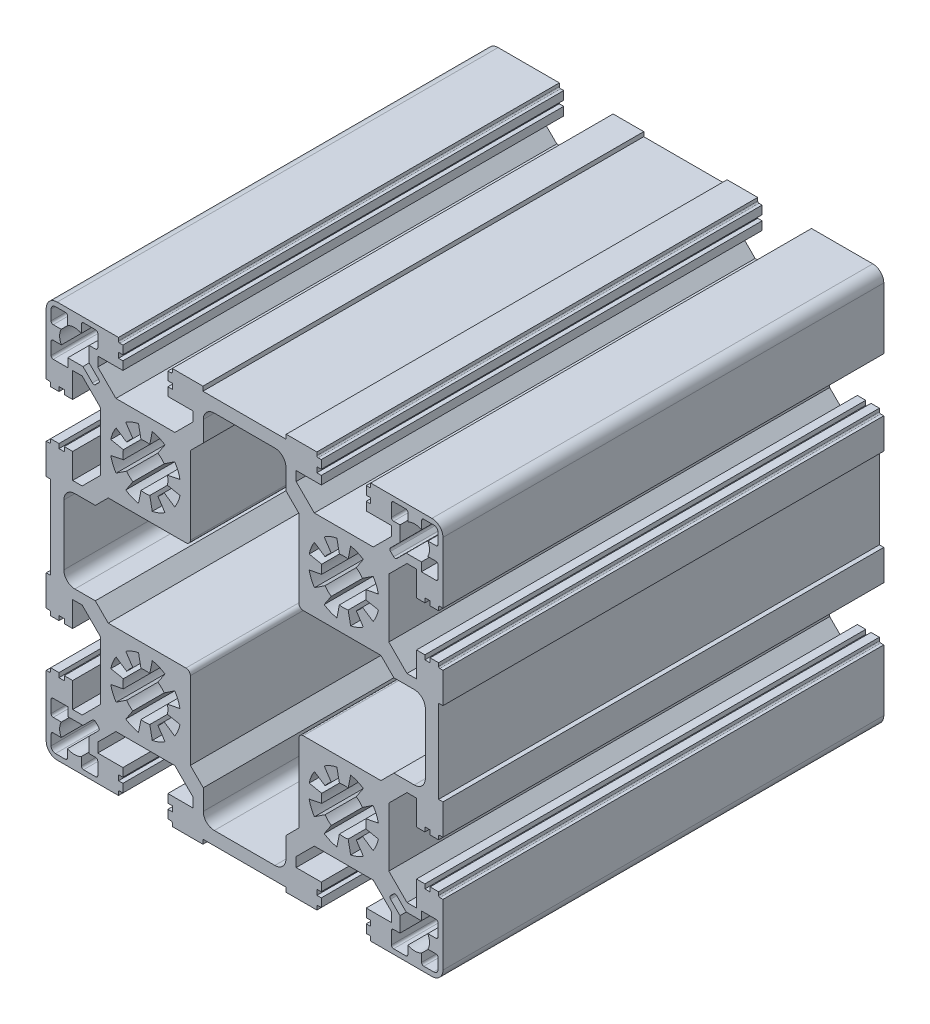
from build123d import *

# Parameters (mm, degrees)
EXTRUDE_1_DEPTH = 100


with BuildPart() as part:
    # 草图1 → 凸台-拉伸1 (new body)
    with BuildSketch(Plane.XY):
        with BuildLine():
            Line((-27.568782805, 44.545792426), (-41.468782805, 44.545792426))
            ThreePointArc((-41.468782805, 44.545792426), (-43.236549758, 43.813559379), (-43.968782805, 42.045792426))
            Line((-43.968782805, 42.045792426), (-43.968782805, 28.145792426))
            Line((-43.968782805, 28.145792426), (-43.268782805, 28.145792426))
            ThreePointArc((-43.268782805, 28.145792426), (-43.056650771, 28.057924461), (-42.968782805, 27.845792426))
            Line((-42.968782805, 27.845792426), (-42.968782805, 27.145792426))
            Line((-42.968782805, 27.145792426), (-41.068782805, 27.145792426))
            Line((-41.068782805, 27.145792426), (-41.068782805, 28.145792426))
            Line((-41.068782805, 28.145792426), (-39.868782805, 28.145792426))
            Line((-39.868782805, 28.145792426), (-39.868782805, 27.145792426))
            Line((-39.868782805, 27.145792426), (-37.968782805, 27.145792426))
            Line((-37.968782805, 27.145792426), (-37.968782805, 32.845792426))
            Line((-37.968782805, 32.845792426), (-35.804316711, 32.845792426))
            Line((-35.804316711, 32.845792426), (-31.688782805, 28.73025852))
            Line((-31.688782805, 28.73025852), (-31.688782805, 15.361326332))
            Line((-31.688782805, 15.361326332), (-35.804316711, 11.245792426))
            Line((-35.804316711, 11.245792426), (-37.968782805, 11.245792426))
            Line((-37.968782805, 11.245792426), (-37.968782805, 16.945792426))
            Line((-37.968782805, 16.945792426), (-39.868782805, 16.945792426))
            Line((-39.868782805, 16.945792426), (-39.868782805, 15.945792426))
            Line((-39.868782805, 15.945792426), (-41.068782805, 15.945792426))
            Line((-41.068782805, 15.945792426), (-41.068782805, 16.945792426))
            Line((-41.068782805, 16.945792426), (-42.968782805, 16.945792426))
            Line((-42.968782805, 16.945792426), (-42.968782805, 16.245792426))
            ThreePointArc((-42.968782805, 16.245792426), (-43.056650771, 16.033660392), (-43.268782805, 15.945792426))
            Line((-43.268782805, 15.945792426), (-43.968782805, 15.945792426))
            Line((-43.968782805, 15.945792426), (-43.968782805, 8.995792433))
            Line((-43.968782805, 8.995792433), (-42.968782805, 8.995792433))
            Line((-42.968782805, 8.995792433), (-42.968782805, -9.904207567))
            Line((-42.968782805, -9.904207567), (-43.968782805, -9.904207567))
            Line((-43.968782805, -9.904207567), (-43.968782805, -16.854207574))
            Line((-43.968782805, -16.854207574), (-43.268782805, -16.854207574))
            ThreePointArc((-43.268782805, -16.854207574), (-43.056650771, -16.942075539), (-42.968782805, -17.154207574))
            Line((-42.968782805, -17.154207574), (-42.968782805, -17.854207574))
            Line((-42.968782805, -17.854207574), (-41.068782805, -17.854207574))
            Line((-41.068782805, -17.854207574), (-41.068782805, -16.854207574))
            Line((-41.068782805, -16.854207574), (-39.868782805, -16.854207574))
            Line((-39.868782805, -16.854207574), (-39.868782805, -17.854207574))
            Line((-39.868782805, -17.854207574), (-37.968782805, -17.854207574))
            Line((-37.968782805, -17.854207574), (-37.968782805, -12.154207574))
            Line((-37.968782805, -12.154207574), (-35.804316711, -12.154207574))
            Line((-35.804316711, -12.154207574), (-31.688782805, -16.26974148))
            Line((-31.688782805, -16.26974148), (-31.688782805, -29.638673668))
            Line((-31.688782805, -29.638673668), (-35.804316711, -33.754207574))
            Line((-35.804316711, -33.754207574), (-37.968782805, -33.754207574))
            Line((-37.968782805, -33.754207574), (-37.968782805, -28.054207574))
            Line((-37.968782805, -28.054207574), (-39.868782805, -28.054207574))
            Line((-39.868782805, -28.054207574), (-39.868782805, -29.054207574))
            Line((-39.868782805, -29.054207574), (-41.068782805, -29.054207574))
            Line((-41.068782805, -29.054207574), (-41.068782805, -28.054207574))
            Line((-41.068782805, -28.054207574), (-42.968782805, -28.054207574))
            Line((-42.968782805, -28.054207574), (-42.968782805, -28.754207574))
            ThreePointArc((-42.968782805, -28.754207574), (-43.056650771, -28.966339608), (-43.268782805, -29.054207574))
            Line((-43.268782805, -29.054207574), (-43.968782805, -29.054207574))
            Line((-43.968782805, -29.054207574), (-43.968782805, -42.954207574))
            ThreePointArc((-43.968782805, -42.954207574), (-43.236549758, -44.721974527), (-41.468782805, -45.454207574))
            Line((-41.468782805, -45.454207574), (-27.568782805, -45.454207574))
            Line((-27.568782805, -45.454207574), (-27.568782805, -44.754207574))
            ThreePointArc((-27.568782805, -44.754207574), (-27.480914839, -44.542075539), (-27.268782805, -44.454207574))
            Line((-27.268782805, -44.454207574), (-26.568782805, -44.454207574))
            Line((-26.568782805, -44.454207574), (-26.568782805, -42.554207574))
            Line((-26.568782805, -42.554207574), (-27.568782805, -42.554207574))
            Line((-27.568782805, -42.554207574), (-27.568782805, -41.354207574))
            Line((-27.568782805, -41.354207574), (-26.568782805, -41.354207574))
            Line((-26.568782805, -41.354207574), (-26.568782805, -39.454207574))
            Line((-26.568782805, -39.454207574), (-32.268782805, -39.454207574))
            Line((-32.268782805, -39.454207574), (-32.268782805, -37.28974148))
            Line((-32.268782805, -37.28974148), (-28.153248899, -33.174207574))
            Line((-28.153248899, -33.174207574), (-14.784316711, -33.174207574))
            Line((-14.784316711, -33.174207574), (-10.668782805, -37.28974148))
            Line((-10.668782805, -37.28974148), (-10.668782805, -39.454207574))
            Line((-10.668782805, -39.454207574), (-16.368782805, -39.454207574))
            Line((-16.368782805, -39.454207574), (-16.368782805, -41.354207574))
            Line((-16.368782805, -41.354207574), (-15.368782805, -41.354207574))
            Line((-15.368782805, -41.354207574), (-15.368782805, -42.554207574))
            Line((-15.368782805, -42.554207574), (-16.368782805, -42.554207574))
            Line((-16.368782805, -42.554207574), (-16.368782805, -44.454207574))
            Line((-16.368782805, -44.454207574), (-15.668782805, -44.454207574))
            ThreePointArc((-15.668782805, -44.454207574), (-15.456650771, -44.542075539), (-15.368782805, -44.754207574))
            Line((-15.368782805, -44.754207574), (-15.368782805, -45.454207574))
            Line((-15.368782805, -45.454207574), (-8.418782805, -45.454207574))
            Line((-8.418782805, -45.454207574), (-8.418782805, -44.454207574))
            Line((-8.418782805, -44.454207574), (10.481217195, -44.454207574))
            Line((10.481217195, -44.454207574), (10.481217195, -45.454207574))
            Line((10.481217195, -45.454207574), (17.431217195, -45.454207574))
            Line((17.431217195, -45.454207574), (17.431217195, -44.754207574))
            ThreePointArc((17.431217195, -44.754207574), (17.519085161, -44.542075539), (17.731217195, -44.454207574))
            Line((17.731217195, -44.454207574), (18.431217195, -44.454207574))
            Line((18.431217195, -44.454207574), (18.431217195, -42.554207574))
            Line((18.431217195, -42.554207574), (17.431217195, -42.554207574))
            Line((17.431217195, -42.554207574), (17.431217195, -41.354207574))
            Line((17.431217195, -41.354207574), (18.431217195, -41.354207574))
            Line((18.431217195, -41.354207574), (18.431217195, -39.454207574))
            Line((18.431217195, -39.454207574), (12.731217195, -39.454207574))
            Line((12.731217195, -39.454207574), (12.731217195, -37.28974148))
            Line((12.731217195, -37.28974148), (16.846751101, -33.174207574))
            Line((16.846751101, -33.174207574), (30.215683289, -33.174207574))
            Line((30.215683289, -33.174207574), (34.331217195, -37.28974148))
            Line((34.331217195, -37.28974148), (34.331217195, -39.454207574))
            Line((34.331217195, -39.454207574), (28.631217195, -39.454207574))
            Line((28.631217195, -39.454207574), (28.631217195, -41.354207574))
            Line((28.631217195, -41.354207574), (29.631217195, -41.354207574))
            Line((29.631217195, -41.354207574), (29.631217195, -42.554207574))
            Line((29.631217195, -42.554207574), (28.631217195, -42.554207574))
            Line((28.631217195, -42.554207574), (28.631217195, -44.454207574))
            Line((28.631217195, -44.454207574), (29.331217195, -44.454207574))
            ThreePointArc((29.331217195, -44.454207574), (29.543349229, -44.542075539), (29.631217195, -44.754207574))
            Line((29.631217195, -44.754207574), (29.631217195, -45.454207574))
            Line((29.631217195, -45.454207574), (43.531217195, -45.454207574))
            ThreePointArc((43.531217195, -45.454207574), (45.298984148, -44.721974527), (46.031217195, -42.954207574))
            Line((46.031217195, -42.954207574), (46.031217195, -29.054207574))
            Line((46.031217195, -29.054207574), (45.331217195, -29.054207574))
            ThreePointArc((45.331217195, -29.054207574), (45.119085161, -28.966339608), (45.031217195, -28.754207574))
            Line((45.031217195, -28.754207574), (45.031217195, -28.054207574))
            Line((45.031217195, -28.054207574), (43.131217195, -28.054207574))
            Line((43.131217195, -28.054207574), (43.131217195, -29.054207574))
            Line((43.131217195, -29.054207574), (41.931217195, -29.054207574))
            Line((41.931217195, -29.054207574), (41.931217195, -28.054207574))
            Line((41.931217195, -28.054207574), (40.031217195, -28.054207574))
            Line((40.031217195, -28.054207574), (40.031217195, -33.754207574))
            Line((40.031217195, -33.754207574), (37.866751101, -33.754207574))
            Line((37.866751101, -33.754207574), (33.751217195, -29.638673668))
            Line((33.751217195, -29.638673668), (33.751217195, -16.26974148))
            Line((33.751217195, -16.26974148), (37.866751101, -12.154207574))
            Line((37.866751101, -12.154207574), (40.031217195, -12.154207574))
            Line((40.031217195, -12.154207574), (40.031217195, -17.854207574))
            Line((40.031217195, -17.854207574), (41.931217195, -17.854207574))
            Line((41.931217195, -17.854207574), (41.931217195, -16.854207574))
            Line((41.931217195, -16.854207574), (43.131217195, -16.854207574))
            Line((43.131217195, -16.854207574), (43.131217195, -17.854207574))
            Line((43.131217195, -17.854207574), (45.031217195, -17.854207574))
            Line((45.031217195, -17.854207574), (45.031217195, -17.154207574))
            ThreePointArc((45.031217195, -17.154207574), (45.119085161, -16.942075539), (45.331217195, -16.854207574))
            Line((45.331217195, -16.854207574), (46.031217195, -16.854207574))
            Line((46.031217195, -16.854207574), (46.031217195, -9.904207567))
            Line((46.031217195, -9.904207567), (45.031217195, -9.904207567))
            Line((45.031217195, -9.904207567), (45.031217195, 8.995792433))
            Line((45.031217195, 8.995792433), (46.031217195, 8.995792433))
            Line((46.031217195, 8.995792433), (46.031217195, 15.945792426))
            Line((46.031217195, 15.945792426), (45.331217195, 15.945792426))
            ThreePointArc((45.331217195, 15.945792426), (45.119085161, 16.033660392), (45.031217195, 16.245792426))
            Line((45.031217195, 16.245792426), (45.031217195, 16.945792426))
            Line((45.031217195, 16.945792426), (43.131217195, 16.945792426))
            Line((43.131217195, 16.945792426), (43.131217195, 15.945792426))
            Line((43.131217195, 15.945792426), (41.931217195, 15.945792426))
            Line((41.931217195, 15.945792426), (41.931217195, 16.945792426))
            Line((41.931217195, 16.945792426), (40.031217195, 16.945792426))
            Line((40.031217195, 16.945792426), (40.031217195, 11.245792426))
            Line((40.031217195, 11.245792426), (37.866751101, 11.245792426))
            Line((37.866751101, 11.245792426), (33.751217195, 15.361326332))
            Line((33.751217195, 15.361326332), (33.751217195, 28.73025852))
            Line((33.751217195, 28.73025852), (37.866751101, 32.845792426))
            Line((37.866751101, 32.845792426), (40.031217195, 32.845792426))
            Line((40.031217195, 32.845792426), (40.031217195, 27.145792426))
            Line((40.031217195, 27.145792426), (41.931217195, 27.145792426))
            Line((41.931217195, 27.145792426), (41.931217195, 28.145792426))
            Line((41.931217195, 28.145792426), (43.131217195, 28.145792426))
            Line((43.131217195, 28.145792426), (43.131217195, 27.145792426))
            Line((43.131217195, 27.145792426), (45.031217195, 27.145792426))
            Line((45.031217195, 27.145792426), (45.031217195, 27.845792426))
            ThreePointArc((45.031217195, 27.845792426), (45.119085161, 28.057924461), (45.331217195, 28.145792426))
            Line((45.331217195, 28.145792426), (46.031217195, 28.145792426))
            Line((46.031217195, 28.145792426), (46.031217195, 42.045792426))
            ThreePointArc((46.031217195, 42.045792426), (45.298984148, 43.813559379), (43.531217195, 44.545792426))
            Line((43.531217195, 44.545792426), (29.631217195, 44.545792426))
            Line((29.631217195, 44.545792426), (29.631217195, 43.845792426))
            ThreePointArc((29.631217195, 43.845792426), (29.543349229, 43.633660392), (29.331217195, 43.545792426))
            Line((29.331217195, 43.545792426), (28.631217195, 43.545792426))
            Line((28.631217195, 43.545792426), (28.631217195, 41.645792426))
            Line((28.631217195, 41.645792426), (29.631217195, 41.645792426))
            Line((29.631217195, 41.645792426), (29.631217195, 40.445792426))
            Line((29.631217195, 40.445792426), (28.631217195, 40.445792426))
            Line((28.631217195, 40.445792426), (28.631217195, 38.545792426))
            Line((28.631217195, 38.545792426), (34.331217195, 38.545792426))
            Line((34.331217195, 38.545792426), (34.331217195, 36.381326332))
            Line((34.331217195, 36.381326332), (30.215683289, 32.265792426))
            Line((30.215683289, 32.265792426), (16.846751101, 32.265792426))
            Line((16.846751101, 32.265792426), (12.731217195, 36.381326332))
            Line((12.731217195, 36.381326332), (12.731217195, 38.545792426))
            Line((12.731217195, 38.545792426), (18.431217195, 38.545792426))
            Line((18.431217195, 38.545792426), (18.431217195, 40.445792426))
            Line((18.431217195, 40.445792426), (17.431217195, 40.445792426))
            Line((17.431217195, 40.445792426), (17.431217195, 41.645792426))
            Line((17.431217195, 41.645792426), (18.431217195, 41.645792426))
            Line((18.431217195, 41.645792426), (18.431217195, 43.545792426))
            Line((18.431217195, 43.545792426), (17.731217195, 43.545792426))
            ThreePointArc((17.731217195, 43.545792426), (17.519085161, 43.633660392), (17.431217195, 43.845792426))
            Line((17.431217195, 43.845792426), (17.431217195, 44.545792426))
            Line((17.431217195, 44.545792426), (10.481217195, 44.545792426))
            Line((10.481217195, 44.545792426), (10.481217195, 43.545792426))
            Line((10.481217195, 43.545792426), (-8.418782805, 43.545792426))
            Line((-8.418782805, 43.545792426), (-8.418782805, 44.545792426))
            Line((-8.418782805, 44.545792426), (-15.368782805, 44.545792426))
            Line((-15.368782805, 44.545792426), (-15.368782805, 43.845792426))
            ThreePointArc((-15.368782805, 43.845792426), (-15.456650771, 43.633660392), (-15.668782805, 43.545792426))
            Line((-15.668782805, 43.545792426), (-16.368782805, 43.545792426))
            Line((-16.368782805, 43.545792426), (-16.368782805, 41.645792426))
            Line((-16.368782805, 41.645792426), (-15.368782805, 41.645792426))
            Line((-15.368782805, 41.645792426), (-15.368782805, 40.445792426))
            Line((-15.368782805, 40.445792426), (-16.368782805, 40.445792426))
            Line((-16.368782805, 40.445792426), (-16.368782805, 38.545792426))
            Line((-16.368782805, 38.545792426), (-10.668782805, 38.545792426))
            Line((-10.668782805, 38.545792426), (-10.668782805, 36.381326332))
            Line((-10.668782805, 36.381326332), (-14.784316711, 32.265792426))
            Line((-14.784316711, 32.265792426), (-28.153248899, 32.265792426))
            Line((-28.153248899, 32.265792426), (-32.268782805, 36.381326332))
            Line((-32.268782805, 36.381326332), (-32.268782805, 38.545792426))
            Line((-32.268782805, 38.545792426), (-26.568782805, 38.545792426))
            Line((-26.568782805, 38.545792426), (-26.568782805, 40.445792426))
            Line((-26.568782805, 40.445792426), (-27.568782805, 40.445792426))
            Line((-27.568782805, 40.445792426), (-27.568782805, 41.645792426))
            Line((-27.568782805, 41.645792426), (-26.568782805, 41.645792426))
            Line((-26.568782805, 41.645792426), (-26.568782805, 43.545792426))
            Line((-26.568782805, 43.545792426), (-27.268782805, 43.545792426))
            ThreePointArc((-27.268782805, 43.545792426), (-27.480914839, 43.633660392), (-27.568782805, 43.845792426))
            Line((-27.568782805, 43.845792426), (-27.568782805, 44.545792426))
        make_face()
        with BuildLine():
            Line((-25.913344669, 15.394035528), (-24.302190993, 17.805297404))
            ThreePointArc((-24.302190993, 17.805297404), (-25.075027389, 18.439547842), (-25.709277828, 19.212384238))
            Line((-25.709277828, 19.212384238), (-28.120539704, 17.601230562))
            ThreePointArc((-28.120539704, 17.601230562), (-28.859819065, 18.984324967), (-29.315065048, 20.48506985))
            Line((-29.315065048, 20.48506985), (-26.470787735, 21.050831784))
            ThreePointArc((-26.470787735, 21.050831784), (-26.568782805, 22.045792426), (-26.470787735, 23.040753069))
            Line((-26.470787735, 23.040753069), (-29.315065048, 23.606515003))
            ThreePointArc((-29.315065048, 23.606515003), (-28.859819065, 25.107259885), (-28.120539704, 26.490354291))
            Line((-28.120539704, 26.490354291), (-25.709277828, 24.879200615))
            ThreePointArc((-25.709277828, 24.879200615), (-25.075027389, 25.65203701), (-24.302190993, 26.286287449))
            Line((-24.302190993, 26.286287449), (-25.913344669, 28.697549325))
            ThreePointArc((-25.913344669, 28.697549325), (-24.530250264, 29.436828686), (-23.029505381, 29.89207467))
            Line((-23.029505381, 29.89207467), (-22.463743447, 27.047797356))
            ThreePointArc((-22.463743447, 27.047797356), (-21.468782805, 27.145792426), (-20.473822163, 27.047797356))
            Line((-20.473822163, 27.047797356), (-19.908060229, 29.89207467))
            ThreePointArc((-19.908060229, 29.89207467), (-18.407315346, 29.436828686), (-17.024220941, 28.697549325))
            Line((-17.024220941, 28.697549325), (-18.635374617, 26.286287449))
            ThreePointArc((-18.635374617, 26.286287449), (-17.862538221, 25.65203701), (-17.228287782, 24.879200615))
            Line((-17.228287782, 24.879200615), (-14.817025907, 26.490354291))
            ThreePointArc((-14.817025907, 26.490354291), (-14.077746545, 25.107259885), (-13.622500562, 23.606515003))
            Line((-13.622500562, 23.606515003), (-16.466777875, 23.040753069))
            ThreePointArc((-16.466777875, 23.040753069), (-16.368782805, 22.045792426), (-16.466777875, 21.050831784))
            Line((-16.466777875, 21.050831784), (-13.622500562, 20.48506985))
            ThreePointArc((-13.622500562, 20.48506985), (-14.077746545, 18.984324967), (-14.817025907, 17.601230562))
            Line((-14.817025907, 17.601230562), (-17.228287782, 19.212384238))
            ThreePointArc((-17.228287782, 19.212384238), (-17.862538221, 18.439547842), (-18.635374617, 17.805297404))
            Line((-18.635374617, 17.805297404), (-17.024220941, 15.394035528))
            ThreePointArc((-17.024220941, 15.394035528), (-18.407315346, 14.654756166), (-19.908060229, 14.199510183))
            Line((-19.908060229, 14.199510183), (-20.473822163, 17.043787496))
            ThreePointArc((-20.473822163, 17.043787496), (-21.468782805, 16.945792426), (-22.463743447, 17.043787496))
            Line((-22.463743447, 17.043787496), (-23.029505381, 14.199510183))
            ThreePointArc((-23.029505381, 14.199510183), (-24.530250264, 14.654756166), (-25.913344669, 15.394035528))
        make_face(mode=Mode.SUBTRACT)
        with BuildLine():
            Line((-42.868782805, 42.445792426), (-42.868782805, 40.145792426))
            ThreePointArc((-42.868782805, 40.145792426), (-42.722336196, 39.792239036), (-42.368782805, 39.645792426))
            Line((-42.368782805, 39.645792426), (-40.564195965, 39.645792426))
            ThreePointArc((-40.564195965, 39.645792426), (-40.918613063, 38.112069422), (-40.533390705, 36.585792426))
            Line((-40.533390705, 36.585792426), (-42.368782805, 36.585792426))
            ThreePointArc((-42.368782805, 36.585792426), (-42.722336196, 36.439345817), (-42.868782805, 36.085792426))
            Line((-42.868782805, 36.085792426), (-42.868782805, 33.345792426))
            ThreePointArc((-42.868782805, 33.345792426), (-42.722336196, 32.992239036), (-42.368782805, 32.845792426))
            Line((-42.368782805, 32.845792426), (-39.068782805, 32.845792426))
            Line((-39.068782805, 32.845792426), (-39.068782805, 34.795792426))
            Line((-39.068782805, 34.795792426), (-35.632996367, 34.795792426))
            Line((-35.632996367, 34.795792426), (-33.489598086, 32.652394144))
            ThreePointArc((-33.489598086, 32.652394144), (-33.136044695, 32.505947535), (-32.782491304, 32.652394145))
            Line((-32.782491304, 32.652394145), (-32.075384522, 33.359500927))
            ThreePointArc((-32.075384522, 33.359500927), (-31.928937912, 33.713054318), (-32.075384522, 34.066607709))
            Line((-32.075384522, 34.066607709), (-34.218782802, 36.210005989))
            Line((-34.218782802, 36.210005989), (-34.218782802, 39.645792426))
            Line((-34.218782802, 39.645792426), (-32.768782805, 39.645792426))
            ThreePointArc((-32.768782805, 39.645792426), (-32.415229414, 39.792239036), (-32.268782805, 40.145792426))
            Line((-32.268782805, 40.145792426), (-32.268782805, 42.945792426))
            ThreePointArc((-32.268782805, 42.945792426), (-32.415229414, 43.299345817), (-32.768782805, 43.445792426))
            Line((-32.768782805, 43.445792426), (-35.508782805, 43.445792426))
            ThreePointArc((-35.508782805, 43.445792426), (-35.862336196, 43.299345817), (-36.008782805, 42.945792426))
            Line((-36.008782805, 42.945792426), (-36.008782805, 41.110400326))
            ThreePointArc((-36.008782805, 41.110400326), (-37.568782805, 41.495792426), (-39.128782805, 41.110400326))
            Line((-39.128782805, 41.110400326), (-39.128782805, 42.945792426))
            ThreePointArc((-39.128782805, 42.945792426), (-39.275229414, 43.299345817), (-39.628782805, 43.445792426))
            Line((-39.628782805, 43.445792426), (-41.868782805, 43.445792426))
            ThreePointArc((-41.868782805, 43.445792426), (-42.575889586, 43.152899208), (-42.868782805, 42.445792426))
        make_face(mode=Mode.SUBTRACT)
        with BuildLine():
            Line((19.086655331, 15.394035528), (20.697809007, 17.805297404))
            ThreePointArc((20.697809007, 17.805297404), (19.924972611, 18.439547842), (19.290722172, 19.212384238))
            Line((19.290722172, 19.212384238), (16.879460296, 17.601230562))
            ThreePointArc((16.879460296, 17.601230562), (16.140180935, 18.984324967), (15.684934952, 20.48506985))
            Line((15.684934952, 20.48506985), (18.529212265, 21.050831784))
            ThreePointArc((18.529212265, 21.050831784), (18.431217195, 22.045792426), (18.529212265, 23.040753069))
            Line((18.529212265, 23.040753069), (15.684934952, 23.606515003))
            ThreePointArc((15.684934952, 23.606515003), (16.140180935, 25.107259885), (16.879460296, 26.490354291))
            Line((16.879460296, 26.490354291), (19.290722172, 24.879200615))
            ThreePointArc((19.290722172, 24.879200615), (19.924972611, 25.65203701), (20.697809007, 26.286287449))
            Line((20.697809007, 26.286287449), (19.086655331, 28.697549325))
            ThreePointArc((19.086655331, 28.697549325), (20.469749736, 29.436828686), (21.970494619, 29.89207467))
            Line((21.970494619, 29.89207467), (22.536256553, 27.047797356))
            ThreePointArc((22.536256553, 27.047797356), (23.531217195, 27.145792426), (24.526177837, 27.047797356))
            Line((24.526177837, 27.047797356), (25.091939771, 29.89207467))
            ThreePointArc((25.091939771, 29.89207467), (26.592684654, 29.436828686), (27.975779059, 28.697549325))
            Line((27.975779059, 28.697549325), (26.364625383, 26.286287449))
            ThreePointArc((26.364625383, 26.286287449), (27.137461779, 25.65203701), (27.771712218, 24.879200615))
            Line((27.771712218, 24.879200615), (30.182974093, 26.490354291))
            ThreePointArc((30.182974093, 26.490354291), (30.922253455, 25.107259885), (31.377499438, 23.606515003))
            Line((31.377499438, 23.606515003), (28.533222125, 23.040753069))
            ThreePointArc((28.533222125, 23.040753069), (28.631217195, 22.045792426), (28.533222125, 21.050831784))
            Line((28.533222125, 21.050831784), (31.377499438, 20.48506985))
            ThreePointArc((31.377499438, 20.48506985), (30.922253455, 18.984324967), (30.182974093, 17.601230562))
            Line((30.182974093, 17.601230562), (27.771712218, 19.212384238))
            ThreePointArc((27.771712218, 19.212384238), (27.137461779, 18.439547842), (26.364625383, 17.805297404))
            Line((26.364625383, 17.805297404), (27.975779059, 15.394035528))
            ThreePointArc((27.975779059, 15.394035528), (26.592684654, 14.654756166), (25.091939771, 14.199510183))
            Line((25.091939771, 14.199510183), (24.526177837, 17.043787496))
            ThreePointArc((24.526177837, 17.043787496), (23.531217195, 16.945792426), (22.536256553, 17.043787496))
            Line((22.536256553, 17.043787496), (21.970494619, 14.199510183))
            ThreePointArc((21.970494619, 14.199510183), (20.469749736, 14.654756166), (19.086655331, 15.394035528))
        make_face(mode=Mode.SUBTRACT)
        with BuildLine():
            Line((36.281217195, 39.645792426), (34.831217195, 39.645792426))
            ThreePointArc((34.831217195, 39.645792426), (34.477663804, 39.792239036), (34.331217195, 40.145792426))
            Line((34.331217195, 40.145792426), (34.331217195, 42.945792426))
            ThreePointArc((34.331217195, 42.945792426), (34.477663804, 43.299345817), (34.831217195, 43.445792426))
            Line((34.831217195, 43.445792426), (37.571217195, 43.445792426))
            ThreePointArc((37.571217195, 43.445792426), (37.924770586, 43.299345817), (38.071217195, 42.945792426))
            Line((38.071217195, 42.945792426), (38.071217195, 41.110400326))
            ThreePointArc((38.071217195, 41.110400326), (39.631217195, 41.495792426), (41.191217195, 41.110400326))
            Line((41.191217195, 41.110400326), (41.191217195, 42.945792426))
            ThreePointArc((41.191217195, 42.945792426), (41.337663804, 43.299345817), (41.691217195, 43.445792426))
            Line((41.691217195, 43.445792426), (43.931217195, 43.445792426))
            ThreePointArc((43.931217195, 43.445792426), (44.638323976, 43.152899208), (44.931217195, 42.445792426))
            Line((44.931217195, 42.445792426), (44.931217195, 40.145792426))
            ThreePointArc((44.931217195, 40.145792426), (44.784770586, 39.792239036), (44.431217195, 39.645792426))
            Line((44.431217195, 39.645792426), (42.626630355, 39.645792426))
            ThreePointArc((42.626630355, 39.645792426), (42.981047453, 38.112069422), (42.595825095, 36.585792426))
            Line((42.595825095, 36.585792426), (44.431217195, 36.585792426))
            ThreePointArc((44.431217195, 36.585792426), (44.784770586, 36.439345817), (44.931217195, 36.085792426))
            Line((44.931217195, 36.085792426), (44.931217195, 33.345792426))
            ThreePointArc((44.931217195, 33.345792426), (44.784770586, 32.992239036), (44.431217195, 32.845792426))
            Line((44.431217195, 32.845792426), (41.131217195, 32.845792426))
            Line((41.131217195, 32.845792426), (41.131217195, 34.795792426))
            Line((41.131217195, 34.795792426), (37.695430761, 34.795792426))
            Line((37.695430761, 34.795792426), (35.552032479, 32.652394144))
            ThreePointArc((35.552032479, 32.652394144), (35.198479088, 32.505947535), (34.844925697, 32.652394145))
            Line((34.844925697, 32.652394145), (34.137818915, 33.359500927))
            ThreePointArc((34.137818915, 33.359500927), (33.991372305, 33.713054318), (34.137818915, 34.066607709))
            Line((34.137818915, 34.066607709), (36.281217195, 36.210005989))
            Line((36.281217195, 36.210005989), (36.281217195, 39.645792426))
        make_face(mode=Mode.SUBTRACT)
        with BuildLine():
            Line((-8.339417601, 33.407390677), (-8.339417601, 38.045792426))
            ThreePointArc((-8.339417601, 38.045792426), (-7.607184554, 39.813559379), (-5.839417601, 40.545792426))
            Line((-5.839417601, 40.545792426), (7.901851991, 40.545792426))
            ThreePointArc((7.901851991, 40.545792426), (9.669618944, 39.813559379), (10.401851991, 38.045792426))
            Line((10.401851991, 38.045792426), (10.401851991, 33.407390677))
            Line((10.401851991, 33.407390677), (13.331217195, 30.478025473))
            Line((13.331217195, 30.478025473), (13.331217195, 12.845792426))
            ThreePointArc((13.331217195, 12.845792426), (13.624110414, 12.138685645), (14.331217195, 11.845792426))
            Line((14.331217195, 11.845792426), (31.963450242, 11.845792426))
            Line((31.963450242, 11.845792426), (34.892815446, 8.916427222))
            Line((34.892815446, 8.916427222), (39.531217195, 8.916427222))
            ThreePointArc((39.531217195, 8.916427222), (41.298984148, 8.184194175), (42.031217195, 6.416427222))
            Line((42.031217195, 6.416427222), (42.031217195, -7.32484237))
            ThreePointArc((42.031217195, -7.32484237), (41.298984148, -9.092609323), (39.531217195, -9.82484237))
            Line((39.531217195, -9.82484237), (34.892815446, -9.82484237))
            Line((34.892815446, -9.82484237), (31.963450242, -12.754207574))
            Line((31.963450242, -12.754207574), (14.331217195, -12.754207574))
            ThreePointArc((14.331217195, -12.754207574), (13.624110414, -13.047100792), (13.331217195, -13.754207574))
            Line((13.331217195, -13.754207574), (13.331217195, -31.386440621))
            Line((13.331217195, -31.386440621), (10.401851991, -34.315805825))
            Line((10.401851991, -34.315805825), (10.401851991, -38.954207574))
            ThreePointArc((10.401851991, -38.954207574), (9.669618944, -40.721974527), (7.901851991, -41.454207574))
            Line((7.901851991, -41.454207574), (-5.839417601, -41.454207574))
            ThreePointArc((-5.839417601, -41.454207574), (-7.607184554, -40.721974527), (-8.339417601, -38.954207574))
            Line((-8.339417601, -38.954207574), (-8.339417601, -34.315805825))
            Line((-8.339417601, -34.315805825), (-11.268782805, -31.386440621))
            Line((-11.268782805, -31.386440621), (-11.268782805, -13.754207574))
            ThreePointArc((-11.268782805, -13.754207574), (-11.561676024, -13.047100792), (-12.268782805, -12.754207574))
            Line((-12.268782805, -12.754207574), (-29.901015852, -12.754207574))
            Line((-29.901015852, -12.754207574), (-32.830381056, -9.82484237))
            Line((-32.830381056, -9.82484237), (-37.468782805, -9.82484237))
            ThreePointArc((-37.468782805, -9.82484237), (-39.236549758, -9.092609323), (-39.968782805, -7.32484237))
            Line((-39.968782805, -7.32484237), (-39.968782805, 6.416427222))
            ThreePointArc((-39.968782805, 6.416427222), (-39.236549758, 8.184194175), (-37.468782805, 8.916427222))
            Line((-37.468782805, 8.916427222), (-32.830381056, 8.916427222))
            Line((-32.830381056, 8.916427222), (-29.901015852, 11.845792426))
            Line((-29.901015852, 11.845792426), (-12.268782805, 11.845792426))
            ThreePointArc((-12.268782805, 11.845792426), (-11.561676024, 12.138685645), (-11.268782805, 12.845792426))
            Line((-11.268782805, 12.845792426), (-11.268782805, 30.478025473))
            Line((-11.268782805, 30.478025473), (-8.339417601, 33.407390677))
        make_face(mode=Mode.SUBTRACT)
        with BuildLine():
            Line((-25.913344669, -16.302450675), (-24.302190993, -18.713712551))
            ThreePointArc((-24.302190993, -18.713712551), (-25.075027389, -19.34796299), (-25.709277828, -20.120799385))
            Line((-25.709277828, -20.120799385), (-28.120539704, -18.509645709))
            ThreePointArc((-28.120539704, -18.509645709), (-28.859819065, -19.892740115), (-29.315065048, -21.393484997))
            Line((-29.315065048, -21.393484997), (-26.470787735, -21.959246931))
            ThreePointArc((-26.470787735, -21.959246931), (-26.568782805, -22.954207574), (-26.470787735, -23.949168216))
            Line((-26.470787735, -23.949168216), (-29.315065048, -24.51493015))
            ThreePointArc((-29.315065048, -24.51493015), (-28.859819065, -26.015675033), (-28.120539704, -27.398769438))
            Line((-28.120539704, -27.398769438), (-25.709277828, -25.787615762))
            ThreePointArc((-25.709277828, -25.787615762), (-25.075027389, -26.560452158), (-24.302190993, -27.194702596))
            Line((-24.302190993, -27.194702596), (-25.913344669, -29.605964472))
            ThreePointArc((-25.913344669, -29.605964472), (-24.530250264, -30.345243834), (-23.029505381, -30.800489817))
            Line((-23.029505381, -30.800489817), (-22.463743447, -27.956212504))
            ThreePointArc((-22.463743447, -27.956212504), (-21.468782805, -28.054207574), (-20.473822163, -27.956212504))
            Line((-20.473822163, -27.956212504), (-19.908060229, -30.800489817))
            ThreePointArc((-19.908060229, -30.800489817), (-18.407315346, -30.345243834), (-17.024220941, -29.605964472))
            Line((-17.024220941, -29.605964472), (-18.635374617, -27.194702596))
            ThreePointArc((-18.635374617, -27.194702596), (-17.862538221, -26.560452158), (-17.228287782, -25.787615762))
            Line((-17.228287782, -25.787615762), (-14.817025907, -27.398769438))
            ThreePointArc((-14.817025907, -27.398769438), (-14.077746545, -26.015675033), (-13.622500562, -24.51493015))
            Line((-13.622500562, -24.51493015), (-16.466777875, -23.949168216))
            ThreePointArc((-16.466777875, -23.949168216), (-16.368782805, -22.954207574), (-16.466777875, -21.959246931))
            Line((-16.466777875, -21.959246931), (-13.622500562, -21.393484997))
            ThreePointArc((-13.622500562, -21.393484997), (-14.077746545, -19.892740115), (-14.817025907, -18.509645709))
            Line((-14.817025907, -18.509645709), (-17.228287782, -20.120799385))
            ThreePointArc((-17.228287782, -20.120799385), (-17.862538221, -19.34796299), (-18.635374617, -18.713712551))
            Line((-18.635374617, -18.713712551), (-17.024220941, -16.302450675))
            ThreePointArc((-17.024220941, -16.302450675), (-18.407315346, -15.563171314), (-19.908060229, -15.10792533))
            Line((-19.908060229, -15.10792533), (-20.473822163, -17.952202644))
            ThreePointArc((-20.473822163, -17.952202644), (-21.468782805, -17.854207574), (-22.463743447, -17.952202644))
            Line((-22.463743447, -17.952202644), (-23.029505381, -15.10792533))
            ThreePointArc((-23.029505381, -15.10792533), (-24.530250264, -15.563171314), (-25.913344669, -16.302450675))
        make_face(mode=Mode.SUBTRACT)
        with BuildLine():
            Line((-42.868782805, -43.354207574), (-42.868782805, -41.054207574))
            ThreePointArc((-42.868782805, -41.054207574), (-42.722336196, -40.700654183), (-42.368782805, -40.554207574))
            Line((-42.368782805, -40.554207574), (-40.564195965, -40.554207574))
            ThreePointArc((-40.564195965, -40.554207574), (-40.918613063, -39.020484569), (-40.533390705, -37.494207574))
            Line((-40.533390705, -37.494207574), (-42.368782805, -37.494207574))
            ThreePointArc((-42.368782805, -37.494207574), (-42.722336196, -37.347760964), (-42.868782805, -36.994207574))
            Line((-42.868782805, -36.994207574), (-42.868782805, -34.254207574))
            ThreePointArc((-42.868782805, -34.254207574), (-42.722336196, -33.900654183), (-42.368782805, -33.754207574))
            Line((-42.368782805, -33.754207574), (-39.068782805, -33.754207574))
            Line((-39.068782805, -33.754207574), (-39.068782805, -35.704207574))
            Line((-39.068782805, -35.704207574), (-35.632996367, -35.704207574))
            Line((-35.632996367, -35.704207574), (-33.489598086, -33.560809292))
            ThreePointArc((-33.489598086, -33.560809292), (-33.136044695, -33.414362682), (-32.782491304, -33.560809292))
            Line((-32.782491304, -33.560809292), (-32.075384522, -34.267916075))
            ThreePointArc((-32.075384522, -34.267916075), (-31.928937912, -34.621469465), (-32.075384522, -34.975022856))
            Line((-32.075384522, -34.975022856), (-34.218782802, -37.118421136))
            Line((-34.218782802, -37.118421136), (-34.218782802, -40.554207574))
            Line((-34.218782802, -40.554207574), (-32.768782805, -40.554207574))
            ThreePointArc((-32.768782805, -40.554207574), (-32.415229414, -40.700654183), (-32.268782805, -41.054207574))
            Line((-32.268782805, -41.054207574), (-32.268782805, -43.854207574))
            ThreePointArc((-32.268782805, -43.854207574), (-32.415229414, -44.207760964), (-32.768782805, -44.354207574))
            Line((-32.768782805, -44.354207574), (-35.508782805, -44.354207574))
            ThreePointArc((-35.508782805, -44.354207574), (-35.862336196, -44.207760964), (-36.008782805, -43.854207574))
            Line((-36.008782805, -43.854207574), (-36.008782805, -42.018815474))
            ThreePointArc((-36.008782805, -42.018815474), (-37.568782805, -42.404207574), (-39.128782805, -42.018815474))
            Line((-39.128782805, -42.018815474), (-39.128782805, -43.854207574))
            ThreePointArc((-39.128782805, -43.854207574), (-39.275229414, -44.207760964), (-39.628782805, -44.354207574))
            Line((-39.628782805, -44.354207574), (-41.868782805, -44.354207574))
            ThreePointArc((-41.868782805, -44.354207574), (-42.575889586, -44.061314355), (-42.868782805, -43.354207574))
        make_face(mode=Mode.SUBTRACT)
        with BuildLine():
            Line((19.086655331, -16.302450675), (20.697809007, -18.713712551))
            ThreePointArc((20.697809007, -18.713712551), (19.924972611, -19.34796299), (19.290722172, -20.120799385))
            Line((19.290722172, -20.120799385), (16.879460296, -18.509645709))
            ThreePointArc((16.879460296, -18.509645709), (16.140180935, -19.892740115), (15.684934952, -21.393484997))
            Line((15.684934952, -21.393484997), (18.529212265, -21.959246931))
            ThreePointArc((18.529212265, -21.959246931), (18.431217195, -22.954207574), (18.529212265, -23.949168216))
            Line((18.529212265, -23.949168216), (15.684934952, -24.51493015))
            ThreePointArc((15.684934952, -24.51493015), (16.140180935, -26.015675033), (16.879460296, -27.398769438))
            Line((16.879460296, -27.398769438), (19.290722172, -25.787615762))
            ThreePointArc((19.290722172, -25.787615762), (19.924972611, -26.560452158), (20.697809007, -27.194702596))
            Line((20.697809007, -27.194702596), (19.086655331, -29.605964472))
            ThreePointArc((19.086655331, -29.605964472), (20.469749736, -30.345243834), (21.970494619, -30.800489817))
            Line((21.970494619, -30.800489817), (22.536256553, -27.956212504))
            ThreePointArc((22.536256553, -27.956212504), (23.531217195, -28.054207574), (24.526177837, -27.956212504))
            Line((24.526177837, -27.956212504), (25.091939771, -30.800489817))
            ThreePointArc((25.091939771, -30.800489817), (26.592684654, -30.345243834), (27.975779059, -29.605964472))
            Line((27.975779059, -29.605964472), (26.364625383, -27.194702596))
            ThreePointArc((26.364625383, -27.194702596), (27.137461779, -26.560452158), (27.771712218, -25.787615762))
            Line((27.771712218, -25.787615762), (30.182974093, -27.398769438))
            ThreePointArc((30.182974093, -27.398769438), (30.922253455, -26.015675033), (31.377499438, -24.51493015))
            Line((31.377499438, -24.51493015), (28.533222125, -23.949168216))
            ThreePointArc((28.533222125, -23.949168216), (28.631217195, -22.954207574), (28.533222125, -21.959246931))
            Line((28.533222125, -21.959246931), (31.377499438, -21.393484997))
            ThreePointArc((31.377499438, -21.393484997), (30.922253455, -19.892740115), (30.182974093, -18.509645709))
            Line((30.182974093, -18.509645709), (27.771712218, -20.120799385))
            ThreePointArc((27.771712218, -20.120799385), (27.137461779, -19.34796299), (26.364625383, -18.713712551))
            Line((26.364625383, -18.713712551), (27.975779059, -16.302450675))
            ThreePointArc((27.975779059, -16.302450675), (26.592684654, -15.563171314), (25.091939771, -15.10792533))
            Line((25.091939771, -15.10792533), (24.526177837, -17.952202644))
            ThreePointArc((24.526177837, -17.952202644), (23.531217195, -17.854207574), (22.536256553, -17.952202644))
            Line((22.536256553, -17.952202644), (21.970494619, -15.10792533))
            ThreePointArc((21.970494619, -15.10792533), (20.469749736, -15.563171314), (19.086655331, -16.302450675))
        make_face(mode=Mode.SUBTRACT)
        with BuildLine():
            Line((36.281217195, -40.554207574), (34.831217195, -40.554207574))
            ThreePointArc((34.831217195, -40.554207574), (34.477663804, -40.700654183), (34.331217195, -41.054207574))
            Line((34.331217195, -41.054207574), (34.331217195, -43.854207574))
            ThreePointArc((34.331217195, -43.854207574), (34.477663804, -44.207760964), (34.831217195, -44.354207574))
            Line((34.831217195, -44.354207574), (37.571217195, -44.354207574))
            ThreePointArc((37.571217195, -44.354207574), (37.924770586, -44.207760964), (38.071217195, -43.854207574))
            Line((38.071217195, -43.854207574), (38.071217195, -42.018815474))
            ThreePointArc((38.071217195, -42.018815474), (39.631217195, -42.404207574), (41.191217195, -42.018815474))
            Line((41.191217195, -42.018815474), (41.191217195, -43.854207574))
            ThreePointArc((41.191217195, -43.854207574), (41.337663804, -44.207760964), (41.691217195, -44.354207574))
            Line((41.691217195, -44.354207574), (43.931217195, -44.354207574))
            ThreePointArc((43.931217195, -44.354207574), (44.638323976, -44.061314355), (44.931217195, -43.354207574))
            Line((44.931217195, -43.354207574), (44.931217195, -41.054207574))
            ThreePointArc((44.931217195, -41.054207574), (44.784770586, -40.700654183), (44.431217195, -40.554207574))
            Line((44.431217195, -40.554207574), (42.626630355, -40.554207574))
            ThreePointArc((42.626630355, -40.554207574), (42.981047453, -39.020484569), (42.595825095, -37.494207574))
            Line((42.595825095, -37.494207574), (44.431217195, -37.494207574))
            ThreePointArc((44.431217195, -37.494207574), (44.784770586, -37.347760964), (44.931217195, -36.994207574))
            Line((44.931217195, -36.994207574), (44.931217195, -34.254207574))
            ThreePointArc((44.931217195, -34.254207574), (44.784770586, -33.900654183), (44.431217195, -33.754207574))
            Line((44.431217195, -33.754207574), (41.131217198, -33.754207574))
            Line((41.131217198, -33.754207574), (41.131217198, -35.704207574))
            Line((41.131217198, -35.704207574), (37.695430761, -35.704207574))
            Line((37.695430761, -35.704207574), (35.552032479, -33.560809292))
            ThreePointArc((35.552032479, -33.560809292), (35.198479088, -33.414362682), (34.844925697, -33.560809293))
            Line((34.844925697, -33.560809293), (34.137818915, -34.267916075))
            ThreePointArc((34.137818915, -34.267916075), (33.991372305, -34.621469465), (34.137818915, -34.975022856))
            Line((34.137818915, -34.975022856), (36.281217195, -37.118421136))
            Line((36.281217195, -37.118421136), (36.281217195, -40.554207574))
        make_face(mode=Mode.SUBTRACT)
    extrude(amount=EXTRUDE_1_DEPTH)


solid = part.part
